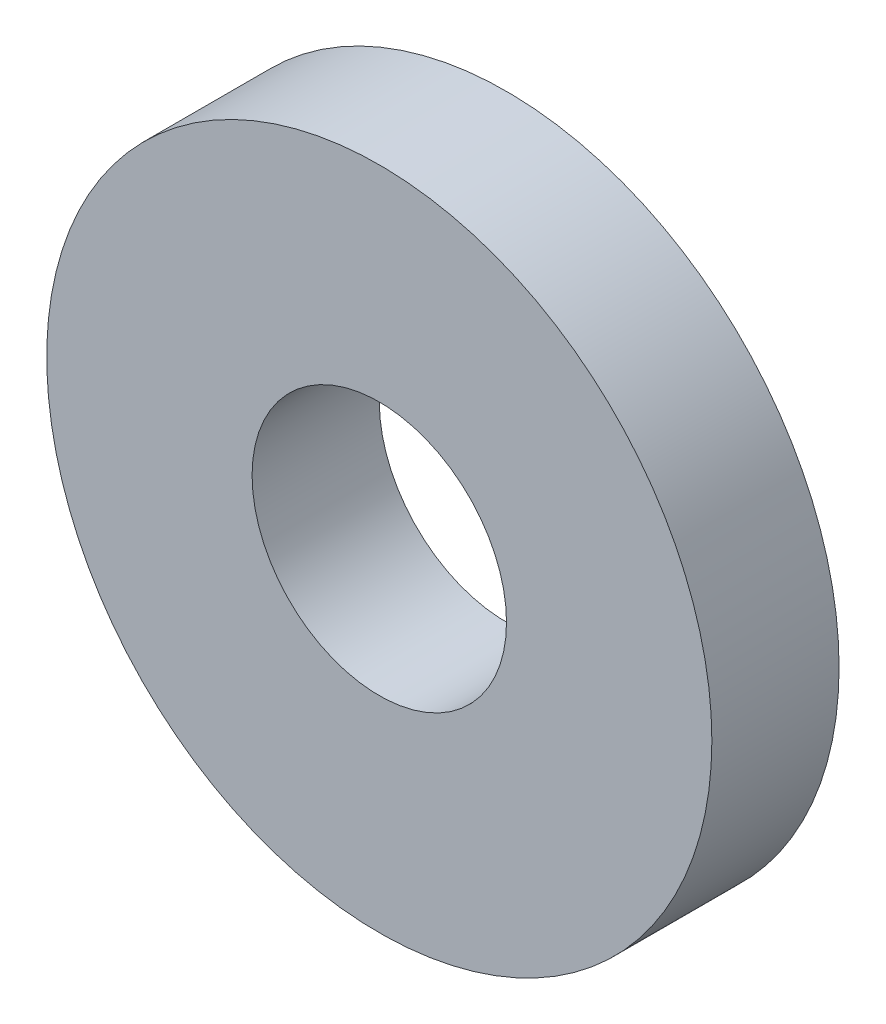
from build123d import *

# Parameters (mm, degrees)
SKETCH1_R           = 4.15
SKETCH1_R_2         = 1.5875
BOSS_EXTRUDE1_DEPTH = 1.5875


with BuildPart() as part:
    # Sketch1 → Boss-Extrude1 (new body)
    with BuildSketch(Plane.XY):
        with Locations((8, 0)):
            Circle(SKETCH1_R)
        with Locations((8, 0)):
            Circle(SKETCH1_R_2, mode=Mode.SUBTRACT)
    extrude(amount=BOSS_EXTRUDE1_DEPTH)


solid = part.part
